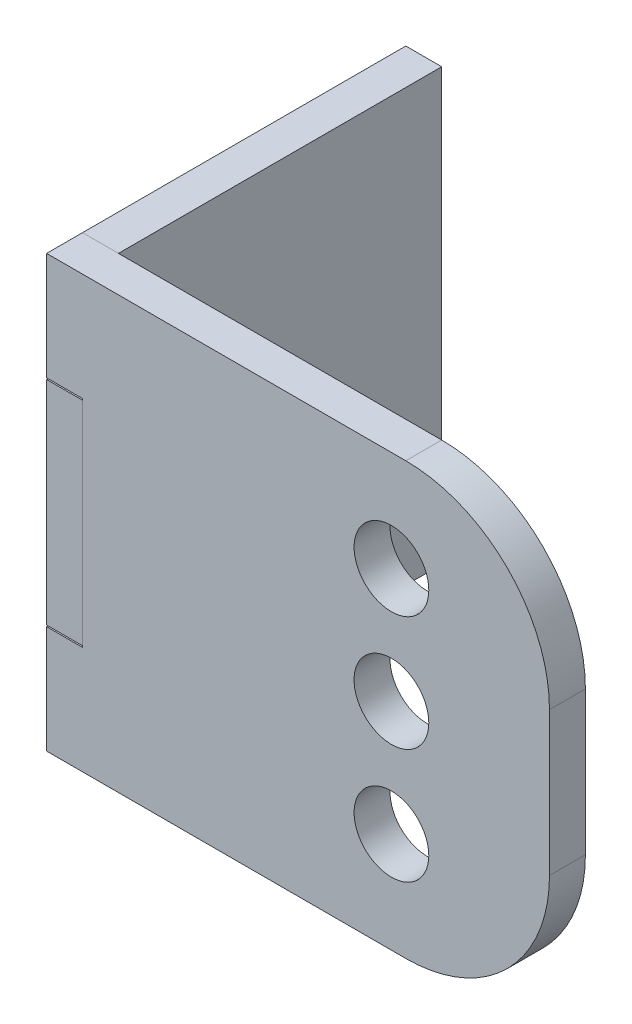
from build123d import *

# Parameters (mm, degrees)
BOSS_EXTRUDE1_DEPTH     = 3.175
CUT_EXTRUDE1_DEPTH      = 49.464271634
CUT_EXTRUDE1_DEPTH_BACK = 49.464271634
SKETCH2_R               = 3.302
SKETCH3_W               = 3.175
SKETCH3_H               = 38.1
BOSS_EXTRUDE2_DEPTH     = 28.575
SKETCH3_4_W             = 3.175
SKETCH3_4_H             = 18.796
BOSS_EXTRUDE5_DEPTH     = 3.175
FILLET1_R               = 12.7


with BuildPart() as part:
    # Sketch1 → Boss-Extrude1 (new body)
    with BuildSketch(Plane.XY):
        Polygon((0, 19.05), (0, 9.525), (3.175, 9.525), (3.175, -9.525), (0, -9.525), (0, -19.05), (44.45, -19.05), (44.45, 19.05), align=None)
    extrude(amount=BOSS_EXTRUDE1_DEPTH)

    # Sketch2 → Cut-Extrude1 (cut, two sides: drawn at the far end of the back side and taken through both)
    with BuildSketch(Plane.XY.offset(3.175).offset(-CUT_EXTRUDE1_DEPTH_BACK)):
        with Locations((30.48, 10.16)):
            Circle(SKETCH2_R)
        with Locations((30.48, -10.16)):
            Circle(SKETCH2_R)
        with Locations((30.48, 0)):
            Circle(SKETCH2_R)
    extrude(amount=CUT_EXTRUDE1_DEPTH + CUT_EXTRUDE1_DEPTH_BACK, mode=Mode.SUBTRACT)

    # Fillet1
    fillet1_edges = [part.edges().sort_by_distance(p)[0] for p in [
        (44.45, -19.05, 1.5875),
        (44.45, 19.05, 1.5875),
    ]]
    fillet(fillet1_edges, radius=FILLET1_R)


with BuildPart() as body_2:
    # Sketch3 → Boss-Extrude2 (new body)
    with BuildSketch(Plane(origin=(0, 0, 0), x_dir=(-1, 0, 0), z_dir=(0, 0, -1))):
        with Locations((-1.5875, 0)):
            Rectangle(SKETCH3_W, SKETCH3_H)
    extrude(amount=BOSS_EXTRUDE2_DEPTH)

    # Sketch3<4> → Boss-Extrude5 (add)
    with BuildSketch(Plane(origin=(0, 0, 0), x_dir=(-1, 0, 0), z_dir=(0, 0, -1))):
        with Locations((-1.5875, 0)):
            Rectangle(SKETCH3_4_W, SKETCH3_4_H)
    extrude(amount=-BOSS_EXTRUDE5_DEPTH)


solid = Compound([part.part, body_2.part])
